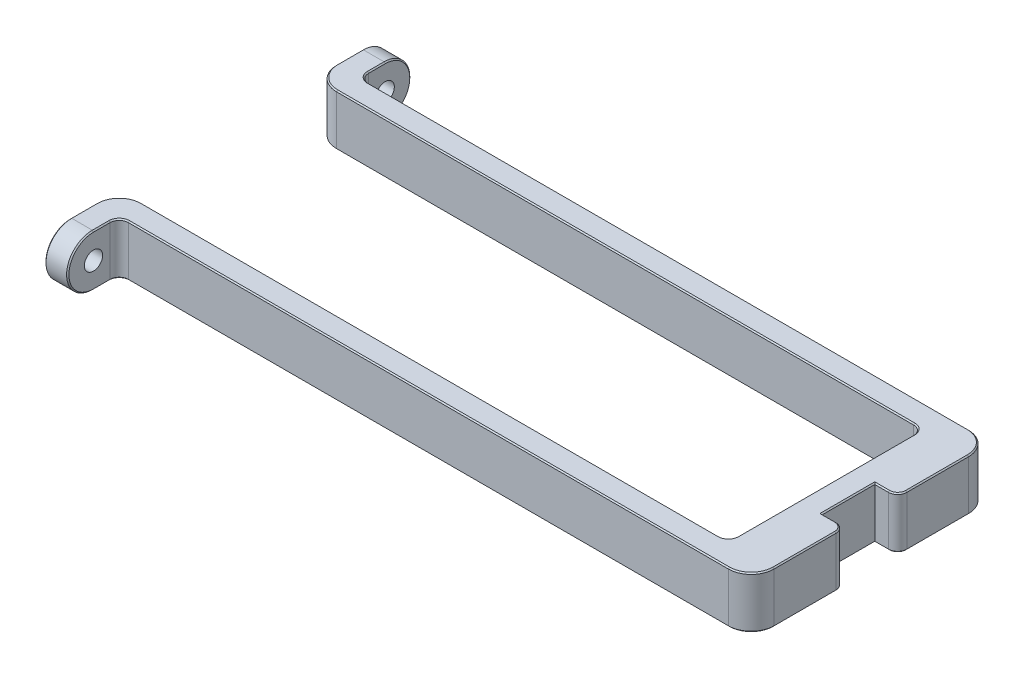
from build123d import *

# Parameters (mm, degrees)
SKETCH_1_W      = 4
SKETCH_1_H      = 16.4
EXTRUDE_1_DEPTH = 9
SKETCH_2_R      = 4.5
SKETCH_2_R_2    = 1.6
EXTRUDE_2_DEPTH = 4
FILLET_1_R      = 4
FILLET_2_R      = 1.6
CHAMFER_1_SIZE  = 0.2


with BuildPart() as part:
    # 草图1 → 凸台-拉伸1 (new body)
    with BuildSketch(Plane(origin=(0, 0, 0), x_dir=(1, 0, 0), z_dir=(0, 1, 0))):
        Polygon((106.5, 0), (0, 0), (0, -4), (110.5, -4), (110.5, 38), (0, 38), (0, 34), (106.5, 34), align=None)
        with Locations((112.5, 29.8)):
            Rectangle(SKETCH_1_W, SKETCH_1_H)
        with Locations((112.5, 4.2)):
            Rectangle(SKETCH_1_W, SKETCH_1_H)
    extrude(amount=EXTRUDE_1_DEPTH)

    # 草图2 → 凸台-拉伸2 (add)
    # profile 1 of 6: a face of its own
    with BuildSketch(Plane.ZY):
        with Locations((-42.5, 4.5)):
            Circle(SKETCH_2_R)
        with Locations((-42.5, 4.5)):
            Circle(SKETCH_2_R_2, mode=Mode.SUBTRACT)
    # profile 2 of 6: a face of its own
    with BuildSketch(Plane.ZY):
        with BuildLine():
            Line((-38, 9), (-42.5, 9))
            ThreePointArc((-42.5, 9), (-39.318019485, 7.681980515), (-38, 4.5))
            Line((-38, 4.5), (-38, 9))
        make_face()
    # profile 3 of 6: a face of its own
    with BuildSketch(Plane.ZY):
        with BuildLine():
            ThreePointArc((-38, 4.5), (-39.318019485, 1.318019485), (-42.5, 0))
            Line((-42.5, 0), (-38, 0))
            Line((-38, 0), (-38, 4.5))
        make_face()
    # profile 4 of 6: a face of its own
    with BuildSketch(Plane.ZY):
        with Locations((8.5, 4.5)):
            Circle(SKETCH_2_R)
        with Locations((8.5, 4.5)):
            Circle(SKETCH_2_R_2, mode=Mode.SUBTRACT)
    # profile 5 of 6: a face of its own
    with BuildSketch(Plane.ZY):
        with BuildLine():
            Line((8.5, 9), (4, 9))
            Line((4, 9), (4, 4.499999989))
            ThreePointArc((4, 4.499999989), (5.318019481, 7.681980511), (8.5, 9))
        make_face()
    # profile 6 of 6: a face of its own
    with BuildSketch(Plane.ZY):
        with BuildLine():
            ThreePointArc((8.5, 0), (5.318019489, 1.318019481), (4, 4.499999989))
            Line((4, 4.499999989), (4, 0))
            Line((4, 0), (8.5, 0))
        make_face()
    extrude(amount=-EXTRUDE_2_DEPTH)

    # 圆角1
    fillet_1_edges = [part.edges().sort_by_distance(p)[0] for p in [
        (0, 4.5, -34),
        (114.5, 4.5, -38),
        (114.5, 4.5, 4),
        (0, 4.5, 0),
    ]]
    fillet(fillet_1_edges, radius=FILLET_1_R)

    # 圆角2
    fillet_2_edges = [part.edges().sort_by_distance(p)[0] for p in [
        (106.5, 4.5, 0),
        (106.5, 4.5, -34),
        (114.5, 4.5, -21.6),
        (114.5, 4.5, -12.4),
        (4, 4.5, -38),
        (4, 4.5, 4),
    ]]
    fillet(fillet_2_edges, radius=FILLET_2_R)

    # 倒角1
    chamfer_1_edges = [part.edges().sort_by_distance(p)[0] for p in [
        (111.7, 0, -12.4),
        (111.7, 9, -12.4),
        (58.05, 0, -38),
        (111.7, 0, -21.6),
        (54.45, 0, 0),
        (106.5, 0, -17),
        (114.03137085, 0, -22.06862915),
        (114.03137085, 0, -11.93137085),
        (58.05, 9, -38),
        (4, 9, -41.05),
        (106.5, 9, -17),
        (54.45, 9, 0),
        (4, 9, 7.05),
        (111.7, 9, -21.6),
        (114.03137085, 9, -22.06862915),
        (114.03137085, 9, -11.93137085),
        (4.46862915, 9, 4.46862915),
        (4.46862915, 0, 4.46862915),
        (4.46862915, 0, -38.46862915),
        (4.46862915, 9, -38.46862915),
        (106.03137085, 0, -0.46862915),
        (106.03137085, 9, -0.46862915),
        (106.03137085, 0, -33.53137085),
        (106.03137085, 9, -33.53137085),
        (110.5, 0, -17),
        (110.5, 9, -17),
        (0, 4.5, -47),
        (4, 0, -41.05),
        (4, 4.5, -47),
        (4, 4.5, 13),
        (4, 0, 7.05),
        (0, 4.5, 13),
        (54.45, 0, -34),
        (0, 0, -40.25),
        (114.5, 0, -28.6),
        (114.5, 0, -5.4),
        (58.05, 0, 4),
        (0, 0, 6.25),
        (1.171572875, 0, -35.171572875),
        (1.171572875, 0, 1.171572875),
        (113.328427125, 0, 2.828427125),
        (113.328427125, 0, -36.828427125),
        (114.5, 9, -28.6),
        (0, 9, 6.25),
        (58.05, 9, 4),
        (114.5, 9, -5.4),
        (0, 9, -40.25),
        (54.45, 9, -34),
        (1.171572875, 9, -35.171572875),
        (1.171572875, 9, 1.171572875),
        (113.328427125, 9, 2.828427125),
        (113.328427125, 9, -36.828427125),
    ]]
    chamfer(chamfer_1_edges, length=CHAMFER_1_SIZE)


solid = part.part
